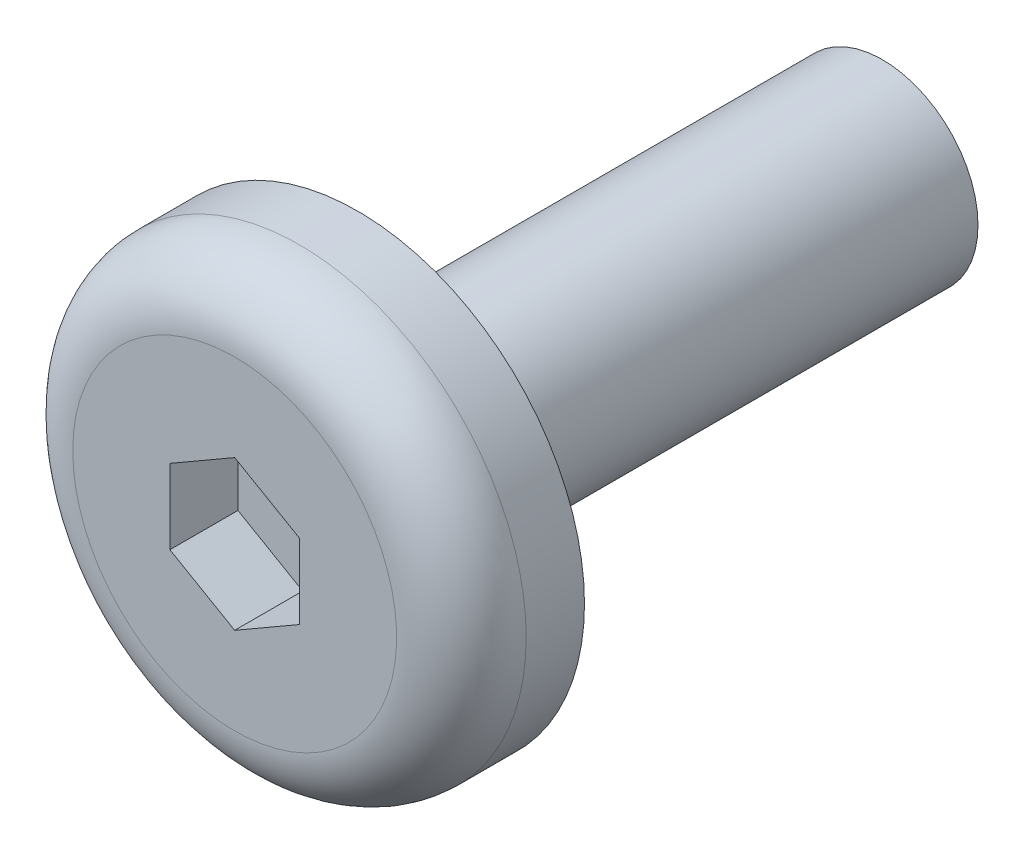
from build123d import *

# Parameters (mm, degrees)
FILLET1_R          = 1
CUT_EXTRUDE1_DEPTH = 1.05


with BuildPart() as part:
    # Sketch1 → Revolve1 (revolve)
    with BuildSketch(Plane(origin=(0, 0, 0), x_dir=(0, 0, -1), z_dir=(1, 0, 0)), mode=Mode.PRIVATE) as revolve1_sk:
        Polygon((1.9, 1.475), (1.9, 3.5), (0, 3.5), (0, 0), (10, 0), (10, 1.475), align=None)
    revolve(revolve1_sk.sketch.rotate(Axis((0, 0, 0), (0, 0, -1)), 90), axis=Axis((0, 0, 0), (0, 0, -1)))

    # Fillet1
    fillet1_edges = [part.edges().sort_by_distance(p)[0] for p in [
        (-3.5, 0, 0),
    ]]
    fillet(fillet1_edges, radius=FILLET1_R)

    # Sketch2 → Cut-Extrude1 (cut)
    with BuildSketch(Plane.XY):
        Polygon((0, 1.154700538), (-1, 0.577350269), (-1, -0.577350269), (0, -1.154700538), (1, -0.577350269), (1, 0.577350269), align=None)
    extrude(amount=-CUT_EXTRUDE1_DEPTH, mode=Mode.SUBTRACT)


solid = part.part
